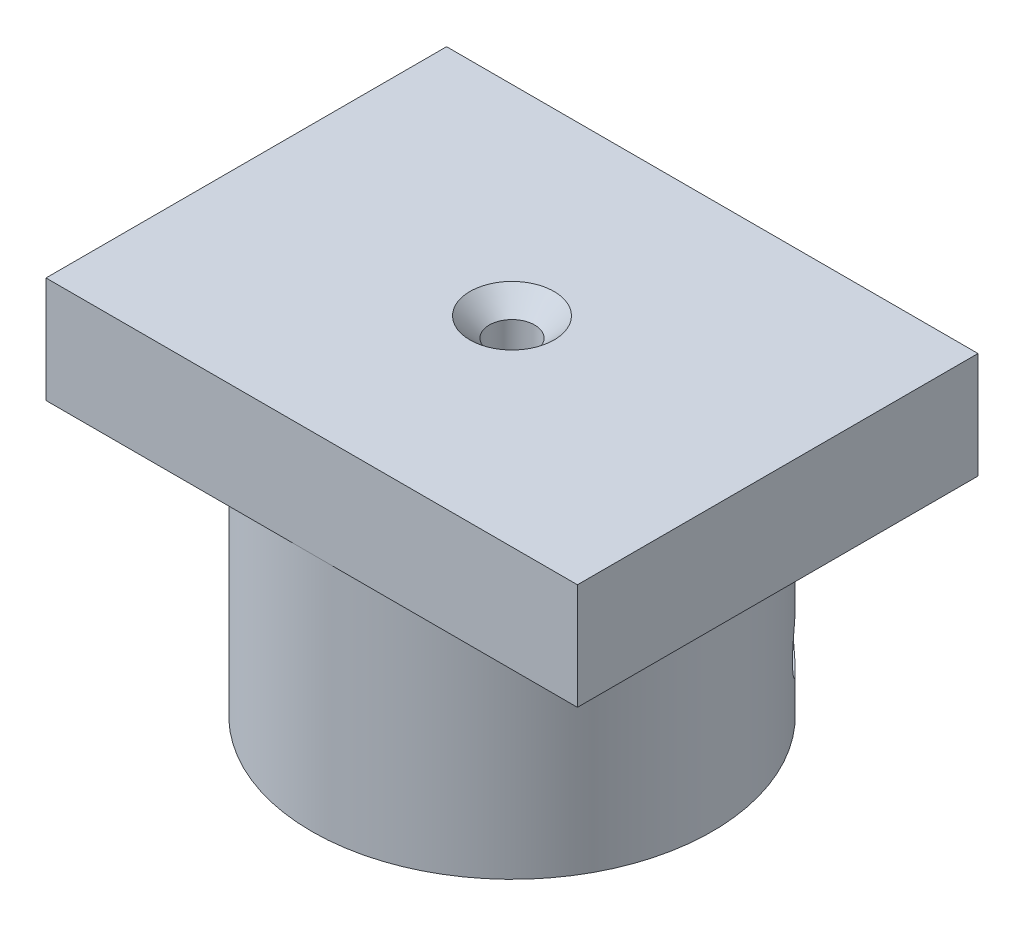
from build123d import *

# Parameters (mm, degrees)
SKETCH1_R                                           = 15
SKETCH1_R_2                                         = 4.5
BOSS_EXTRUDE1_DEPTH                                 = 9
SKETCH2_W                                           = 39.8
SKETCH2_H                                           = 30
SKETCH2_R                                           = 1.5
BOSS_EXTRUDE2_DEPTH                                 = 7.95
CSK_FOR_M3_COUNTERSUNK_FLAT_HEAD_SCREW1_D           = 3.4
CSK_FOR_M3_COUNTERSUNK_FLAT_HEAD_SCREW1_CSINK_D     = 6.3
CSK_FOR_M3_COUNTERSUNK_FLAT_HEAD_SCREW1_CSINK_ANGLE = 90
M5_TAPPED_HOLE1_REACH                               = 45.286
M5_TAPPED_HOLE1_BORE_R                              = 2.1
M5_TAPPED_HOLE2_REACH                               = 45.286
M5_TAPPED_HOLE2_BORE_R                              = 2.1


with BuildPart() as part:
    # Sketch1 → Boss-Extrude1 (new, symmetric)
    with BuildSketch(Plane(origin=(0, 0, 0), x_dir=(1, 0, 0), z_dir=(0, 1, 0))):
        with Locations(Location((0, 0, 0), (0, 0, 270))):
            Circle(SKETCH1_R)
        with Locations(Location((0, 0, 0), (0, 0, 270))):
            Circle(SKETCH1_R_2, mode=Mode.SUBTRACT)
    extrude(amount=BOSS_EXTRUDE1_DEPTH, both=True)

    # Sketch2 → Boss-Extrude2 (add)
    with BuildSketch(Plane(origin=(0, 9, 0), x_dir=(1, 0, 0), z_dir=(0, 1, 0))):
        Rectangle(SKETCH2_W, SKETCH2_H)
        with Locations(Location((0, 0, 0), (0, 0, 270))):
            Circle(SKETCH2_R, mode=Mode.SUBTRACT)
    extrude(amount=BOSS_EXTRUDE2_DEPTH)

    # CSK for M3 Countersunk Flat Head Screw1 (through all)
    with Locations(Plane(origin=(0, 16.95, 0), x_dir=(1, 0, 0), z_dir=(0, 1, 0))):
        with Locations((0, 0)):
            CounterSinkHole(CSK_FOR_M3_COUNTERSUNK_FLAT_HEAD_SCREW1_D / 2, CSK_FOR_M3_COUNTERSUNK_FLAT_HEAD_SCREW1_CSINK_D / 2, counter_sink_angle=CSK_FOR_M3_COUNTERSUNK_FLAT_HEAD_SCREW1_CSINK_ANGLE)

    # M5 Tapped Hole1 bore → M5 Tapped Hole1 (cut, up to next)
    with BuildSketch(Plane(origin=(10.606601718, 0, -10.606601718), x_dir=(-0.7071067811865476, 0, -0.7071067811865476), z_dir=(0.7071067811865476, 0, -0.7071067811865476)), mode=Mode.PRIVATE) as m5_tapped_hole1_sk1:
        with Locations((0, -4)):
            Circle(M5_TAPPED_HOLE1_BORE_R)
    m5_tapped_hole1_tool1 = extrude(m5_tapped_hole1_sk1.sketch, amount=-M5_TAPPED_HOLE1_REACH, mode=Mode.PRIVATE) & part.part
    add(m5_tapped_hole1_tool1.solids().sort_by_distance((10.606602, -4, -10.606602))[0], mode=Mode.SUBTRACT)

    # M5 Tapped Hole2 bore → M5 Tapped Hole2 (cut, up to next)
    with BuildSketch(Plane(origin=(-10.606601718, 0, -10.606601718), x_dir=(-0.7071067811865476, 0, 0.7071067811865476), z_dir=(-0.7071067811865476, 0, -0.7071067811865476)), mode=Mode.PRIVATE) as m5_tapped_hole2_sk1:
        with Locations((0, -4)):
            Circle(M5_TAPPED_HOLE2_BORE_R)
    m5_tapped_hole2_tool1 = extrude(m5_tapped_hole2_sk1.sketch, amount=-M5_TAPPED_HOLE2_REACH, mode=Mode.PRIVATE) & part.part
    add(m5_tapped_hole2_tool1.solids().sort_by_distance((-10.606602, -4, -10.606602))[0], mode=Mode.SUBTRACT)


solid = part.part
